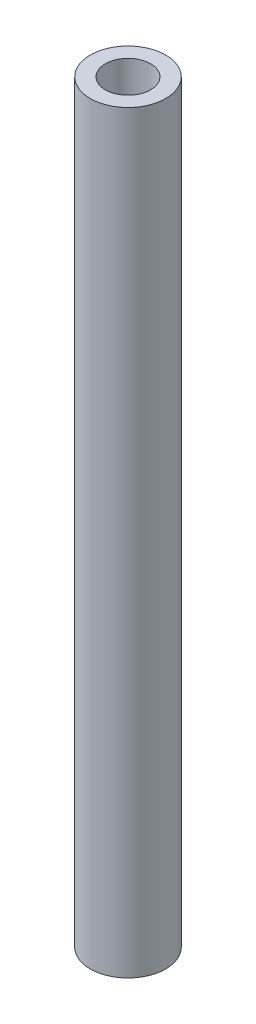
from build123d import *

# Parameters (mm, degrees)
SKETCH_1_R      = 2.5
SKETCH_1_R_2    = 1.5
EXTRUDE_1_DEPTH = 50


with BuildPart() as part:
    # 草图1 → 凸台-拉伸1 (new body)
    with BuildSketch(Plane(origin=(0, 0, 0), x_dir=(1, 0, 0), z_dir=(0, 1, 0))):
        with Locations(Location((0, 0, 0), (0, 0, 270))):
            Circle(SKETCH_1_R)
        with Locations(Location((0, 0, 0), (0, 0, 270))):
            Circle(SKETCH_1_R_2, mode=Mode.SUBTRACT)
    extrude(amount=EXTRUDE_1_DEPTH)


solid = part.part
